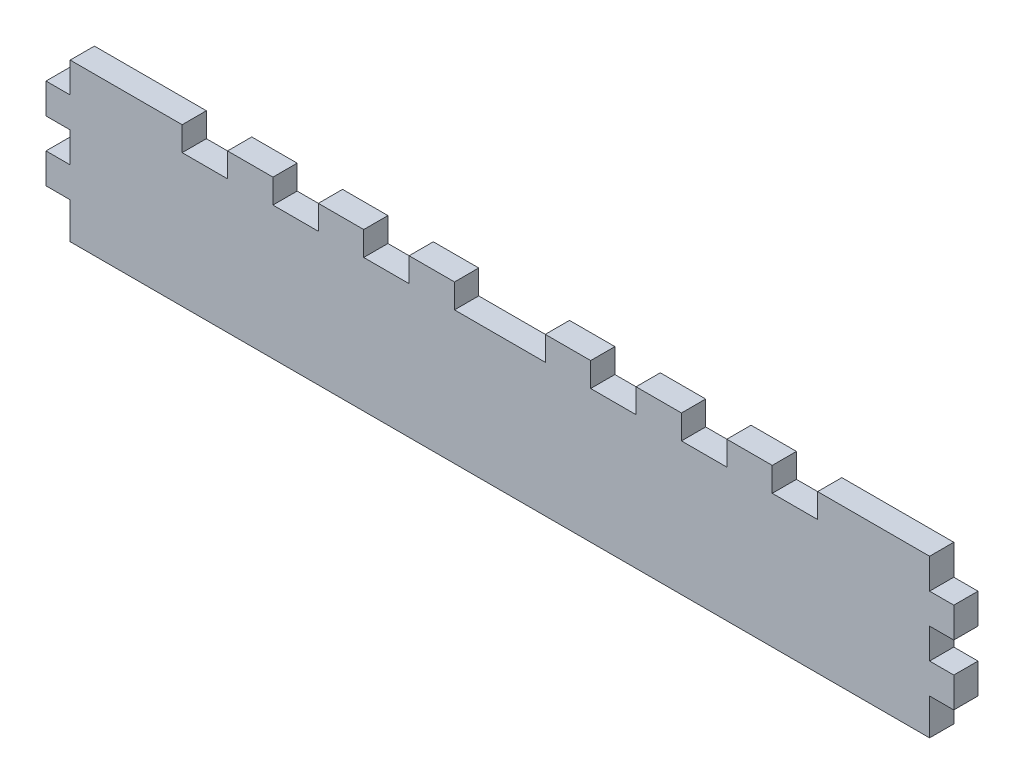
from build123d import *

# Parameters (mm, degrees)
ESQUISSE1_W             = 300
ESQUISSE1_H             = 52
BOSS_EXTRU_1_DEPTH      = 8
ESQUISSE2_W             = 8
ESQUISSE2_H             = 10
ENL_V_MAT_EXTRU_1_DEPTH = 153.446712001
ESQUISSE3_W             = 8
ESQUISSE3_H             = 2
ENL_V_MAT_EXTRU_2_DEPTH = 153.446712001
ESQUISSE4_W             = 15
ESQUISSE4_H             = 8
ENL_V_MAT_EXTRU_3_DEPTH = 10


with BuildPart() as part:
    # Esquisse1 → Boss.-Extru.1 (new body)
    with BuildSketch(Plane.XY):
        Rectangle(ESQUISSE1_W, ESQUISSE1_H)
    extrude(amount=BOSS_EXTRU_1_DEPTH)

    # Esquisse2 → Enlèv. mat.-Extru.1 (cut, through all)
    with BuildSketch(Plane.XY):
        with Locations((-146, 1)):
            Rectangle(ESQUISSE2_W, ESQUISSE2_H)
        with Locations((-146, 21)):
            Rectangle(ESQUISSE2_W, ESQUISSE2_H)
        with Locations((-146, -19)):
            Rectangle(ESQUISSE2_W, ESQUISSE2_H)
    enl_v_mat_extru_1 = extrude(amount=ENL_V_MAT_EXTRU_1_DEPTH, mode=Mode.SUBTRACT)

    # Esquisse3 → Enlèv. mat.-Extru.2 (cut, through all)
    with BuildSketch(Plane.XY):
        with Locations((-146, -25)):
            Rectangle(ESQUISSE3_W, ESQUISSE3_H)
    enl_v_mat_extru_2 = extrude(amount=ENL_V_MAT_EXTRU_2_DEPTH, mode=Mode.SUBTRACT)

    # Symétrie1: Enlèv. mat.-Extru.1, Enlèv. mat.-Extru.2 across plane
    add(enl_v_mat_extru_1.mirror(Plane(origin=(0, 0, 0), x_dir=(0, 0, 1), z_dir=(1, 0, 0))), mode=Mode.SUBTRACT)
    add(enl_v_mat_extru_2.mirror(Plane(origin=(0, 0, 0), x_dir=(0, 0, 1), z_dir=(1, 0, 0))), mode=Mode.SUBTRACT)

    # Esquisse4 → Enlèv. mat.-Extru.3 (cut)
    with BuildSketch(Plane.XY):
        with Locations((-97.5, 22)):
            Rectangle(ESQUISSE4_W, ESQUISSE4_H)
        with Locations((-37.5, 22)):
            Rectangle(ESQUISSE4_W, ESQUISSE4_H)
        with Locations((37.5, 22)):
            Rectangle(ESQUISSE4_W, ESQUISSE4_H)
        with Locations((67.5, 22)):
            Rectangle(ESQUISSE4_W, ESQUISSE4_H)
        with Locations((97.5, 22)):
            Rectangle(ESQUISSE4_W, ESQUISSE4_H)
        with Locations((-67.5, 22)):
            Rectangle(ESQUISSE4_W, ESQUISSE4_H)
        Polygon((0, 18), (15, 18), (15, 26), (0, 26), (-15, 26), (-15, 18), align=None)
    extrude(amount=ENL_V_MAT_EXTRU_3_DEPTH, mode=Mode.SUBTRACT)


solid = part.part
